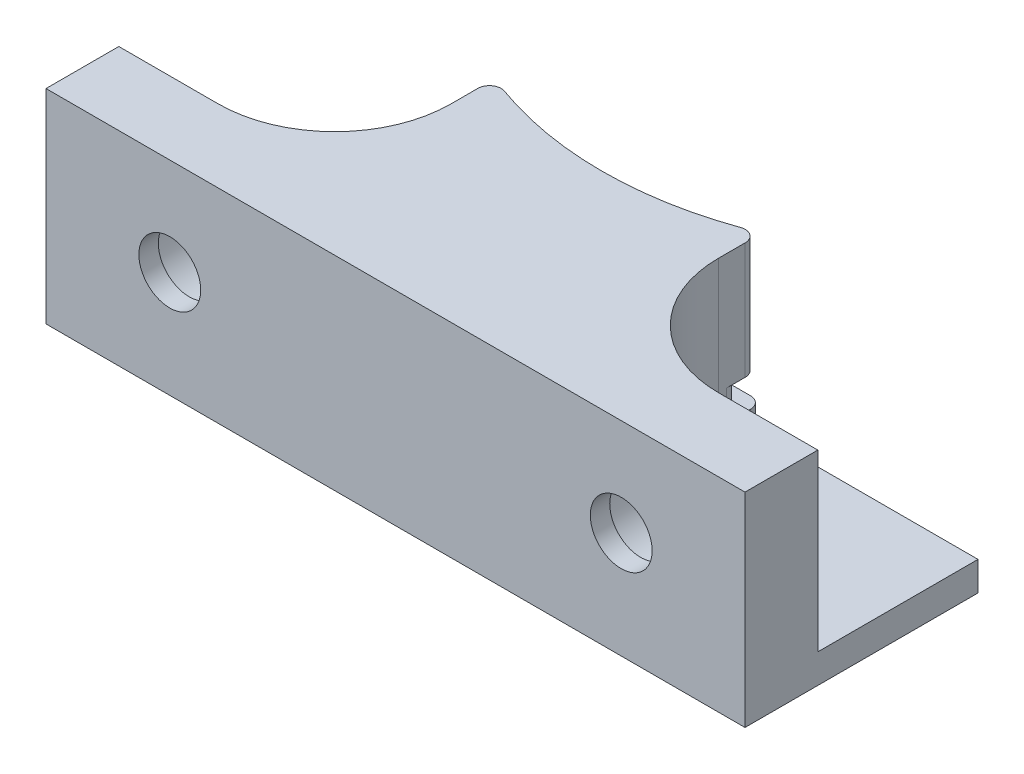
from build123d import *

# Parameters (mm, degrees)
BOSS_EXTRUDE1_DEPTH     = 25.4
BOSS_EXTRUDE2_DEPTH     = 6.604
SKETCH3_W               = 152.4
SKETCH3_H               = 50.8
BOSS_EXTRUDE3_DEPTH     = 12.446
SKETCH5_W               = 47.049242613
SKETCH5_H               = 34.925
CUT_EXTRUDE1_DEPTH      = 38.1
FILLET1_R               = 2.54
FILLET2_R               = 25.4
CUT_EXTRUDE2_DEPTH      = 11.6332
CUT_EXTRUDE2_DEPTH_BACK = 85.242269675
CUT_EXTRUDE2_START      = 9.525
SKETCH6_R               = 9.9187
SKETCH7_R               = 6.7437
CUT_EXTRUDE3_DEPTH      = 93.840002113


with BuildPart() as part:
    # Sketch1 → Boss-Extrude1 (new body)
    with BuildSketch(Plane(origin=(0, 0, 0), x_dir=(1, 0, 0), z_dir=(0, 1, 0))):
        with BuildLine():
            Line((76.2, -25.4), (76.2, 25.4))
            Line((76.2, 25.4), (29.150757387, 25.4))
            ThreePointArc((29.150757387, 25.4), (0, 19.601553837), (-29.150757387, 25.4))
            Line((-29.150757387, 25.4), (-76.2, 25.4))
            Line((-76.2, 25.4), (-76.2, -25.4))
            Line((-76.2, -25.4), (76.2, -25.4))
        make_face()
    extrude(amount=BOSS_EXTRUDE1_DEPTH)

    # Sketch2 → Boss-Extrude2 (add)
    with BuildSketch(Plane.XZ):
        with BuildLine():
            Line((-76.2, 25.4), (76.2, 25.4))
            Line((76.2, 25.4), (76.2, -21.59))
            Line((76.2, -21.59), (29.966893046, -21.59))
            ThreePointArc((29.966893046, -21.59), (0, -15.766153837), (-29.966893046, -21.59))
            Line((-29.966893046, -21.59), (-76.2, -21.59))
            Line((-76.2, -21.59), (-76.2, 25.4))
        make_face()
    extrude(amount=BOSS_EXTRUDE2_DEPTH)

    # Sketch3 → Boss-Extrude3 (add)
    with BuildSketch(Plane.XZ.offset(6.604)):
        Rectangle(SKETCH3_W, SKETCH3_H)
    extrude(amount=BOSS_EXTRUDE3_DEPTH)

    # Sketch5 → Cut-Extrude1 (cut)
    with BuildSketch(Plane(origin=(0, 25.4, 0), x_dir=(1, 0, 0), z_dir=(0, 1, 0))):
        with Locations((-52.675378694, 7.9375)):
            Rectangle(SKETCH5_W, SKETCH5_H)
        with Locations((52.675378694, 7.9375)):
            Rectangle(SKETCH5_W, SKETCH5_H)
    extrude(amount=-CUT_EXTRUDE1_DEPTH, mode=Mode.SUBTRACT)

    # Fillet1
    fillet1_edges = [part.edges().sort_by_distance(p)[0] for p in [
        (29.150757387, 12.7, -25.4),
        (-29.150757387, 12.7, -25.4),
        (-29.150757387, -9.652, -25.4),
        (-29.150757387, -3.302, -21.265527456),
        (29.150757387, -9.652, -25.4),
        (29.150757387, -3.302, -21.265527456),
    ]]
    fillet(fillet1_edges, radius=FILLET1_R)

    # Fillet2
    fillet2_edges = [part.edges().sort_by_distance(p)[0] for p in [
        (-29.150757387, 6.35, 9.525),
        (29.150757387, 6.35, 9.525),
    ]]
    fillet(fillet2_edges, radius=FILLET2_R)

    # Sketch6 → Cut-Extrude2 (cut, two sides: drawn at the far end of the back side and taken through both)
    with BuildSketch(Plane.XY.offset(CUT_EXTRUDE2_START - CUT_EXTRUDE2_DEPTH_BACK)):
        with Locations(Location((49.2125, 4.191, 0), (0, 0, 302.561278337))):
            Circle(SKETCH6_R)
        with Locations(Location((-49.2125, 4.191, 0), (0, 0, 237.438721663))):
            Circle(SKETCH6_R)
    extrude(amount=CUT_EXTRUDE2_DEPTH + CUT_EXTRUDE2_DEPTH_BACK, mode=Mode.SUBTRACT)

    # Sketch7 → Cut-Extrude3 (cut, through all)
    with BuildSketch(Plane(origin=(0, 0, 21.1582), x_dir=(-1, 0, 0), z_dir=(0, 0, -1))):
        with Locations((-49.2125, 4.191)):
            Circle(SKETCH7_R)
        with Locations((49.2125, 4.191)):
            Circle(SKETCH7_R)
    extrude(amount=-CUT_EXTRUDE3_DEPTH, mode=Mode.SUBTRACT)


solid = part.part
